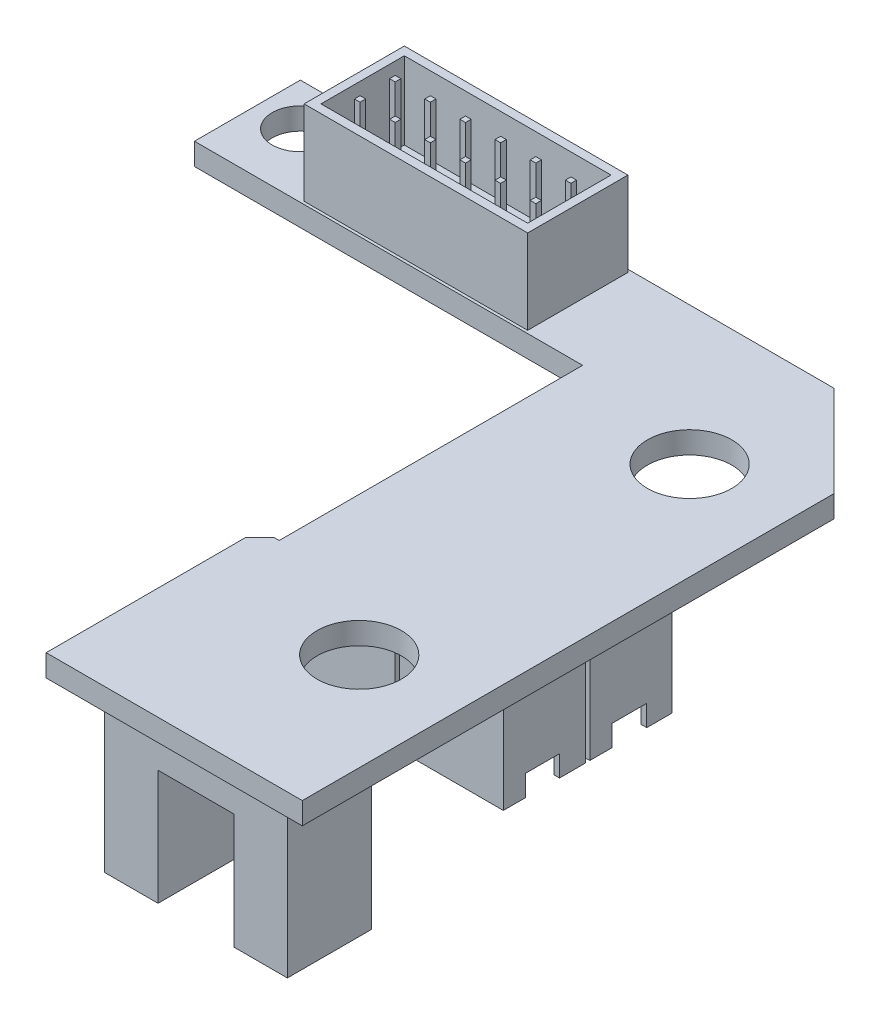
from build123d import *

# Parameters (mm, degrees)
EXTRUDE_1_DEPTH           = 1.56
SKETCH_2_W                = 7.53
SKETCH_2_H                = 1.56
EXTRUDE_2_DEPTH           = 27.61
SKETCH_3_W                = 7.84
SKETCH_3_H                = 5.85
EXTRUDE_3_DEPTH           = 7
SKETCH_4_W                = 7.04
SKETCH_4_H                = 5.05
CUT_EXTRUDE_1_DEPTH       = 6
SKETCH_5_W                = 2.414618678
SKETCH_5_H                = 1.5
CUT_EXTRUDE_2_DEPTH       = 54.380425251
SKETCH_6_W                = 2.414618678
SKETCH_6_H                = 1.5
CUT_EXTRUDE_3_DEPTH       = 58.697939305
SKETCH_7_W                = 7.4
SKETCH_7_H                = 5.85
EXTRUDE_4_DEPTH           = 7
SKETCH_8_W                = 6.6
SKETCH_8_H                = 5.05
CUT_EXTRUDE_4_DEPTH       = 6
SKETCH_9_W                = 2.456250035
SKETCH_9_H                = 1.5
CUT_EXTRUDE_5_DEPTH       = 59.136668291
SKETCH_10_W               = 2.456250035
SKETCH_10_H               = 1.5
CUT_EXTRUDE_6_DEPTH       = 63.78512722
SKETCH_11_W               = 7.4
SKETCH_11_H               = 5.85
EXTRUDE_5_DEPTH           = 7
SKETCH_12_W               = 6.6
SKETCH_12_H               = 5.05
CUT_EXTRUDE_7_DEPTH       = 6
SKETCH_13_W               = 2.414618678
SKETCH_13_H               = 1.5
CUT_EXTRUDE_8_DEPTH       = 59.136668291
SKETCH_14_W               = 2.414618678
SKETCH_14_H               = 1.5
CUT_EXTRUDE_9_DEPTH       = 63.78512722
SKETCH_15_W               = 7.84
SKETCH_15_H               = 5.85
EXTRUDE_6_DEPTH           = 7
SKETCH_16_W               = 7.04
SKETCH_16_H               = 5.05
CUT_EXTRUDE_10_DEPTH      = 6
SKETCH_17_W               = 2.456250035
SKETCH_17_H               = 1.5
CUT_EXTRUDE_11_DEPTH      = 54.380425251
SKETCH_18_W               = 2.456250035
SKETCH_18_H               = 1.5
CUT_EXTRUDE_12_DEPTH      = 58.697939305
SKETCH_19_W               = 13
SKETCH_19_H               = 6
EXTRUDE_7_DEPTH           = 10
CUT_EXTRUDE_13_REACH      = 65.749
SKETCH_20_W               = 5.4
SKETCH_20_H               = 8.2
SKETCH_21_W               = 0.837550725
SKETCH_21_H               = 0.544674091
EXTRUDE_8_DEPTH           = 4.5
SKETCH_22_W               = 0.837550725
SKETCH_22_H               = 0.544674091
EXTRUDE_9_DEPTH           = 4.5
SKETCH_23_W               = 0.837939267
SKETCH_23_H               = 0.544674091
EXTRUDE_10_DEPTH          = 4.5
SKETCH_24_W               = 0.837939267
SKETCH_24_H               = 0.544674091
EXTRUDE_11_DEPTH          = 4.5
SKETCH_25_W               = 0.837550725
SKETCH_25_H               = 0.544674091
EXTRUDE_12_DEPTH          = 4.5
SKETCH_26_W               = 0.837550725
SKETCH_26_H               = 0.544674091
EXTRUDE_13_DEPTH          = 4.5
SKETCH_27_W               = 0.837939267
SKETCH_27_H               = 0.544674091
EXTRUDE_14_DEPTH          = 4.5
SKETCH_28_W               = 0.837939267
SKETCH_28_H               = 0.544674091
EXTRUDE_15_DEPTH          = 4.5
SKETCH_29_W               = 15.9
SKETCH_29_H               = 7.13
EXTRUDE_16_DEPTH          = 6
SKETCH_30_W               = 14.7
SKETCH_30_H               = 5.93
CUT_EXTRUDE_14_DEPTH      = 5.5
SKETCH_31_W               = 0.4
SKETCH_31_H               = 0.4
EXTRUDE_17_DEPTH          = 5.5
SKETCH_32_W               = 0.4
SKETCH_32_H               = 0.4
EXTRUDE_18_DEPTH          = 5.5
SKETCH_33_W               = 0.4
SKETCH_33_H               = 0.4
EXTRUDE_19_DEPTH          = 5.5
SKETCH_34_W               = 0.4
SKETCH_34_H               = 0.4
EXTRUDE_20_DEPTH          = 5.5
SKETCH_35_W               = 0.4
SKETCH_35_H               = 0.4
EXTRUDE_21_DEPTH          = 5.5
SKETCH_36_W               = 0.4
SKETCH_36_H               = 0.4
EXTRUDE_22_DEPTH          = 5.5
SKETCH_37_W               = 0.4
SKETCH_37_H               = 0.4
EXTRUDE_23_DEPTH          = 5.5
SKETCH_38_W               = 0.4
SKETCH_38_H               = 0.4
EXTRUDE_24_DEPTH          = 5.5
SKETCH_39_W               = 0.4
SKETCH_39_H               = 0.4
EXTRUDE_25_DEPTH          = 5.5
SKETCH_40_W               = 0.4
SKETCH_40_H               = 0.4
EXTRUDE_26_DEPTH          = 5.5
SKETCH_41_W               = 0.4
SKETCH_41_H               = 0.4
EXTRUDE_27_DEPTH          = 5.5
SKETCH_42_W               = 0.4
SKETCH_42_H               = 0.4
EXTRUDE_28_DEPTH          = 5.5
HOLE_WIZARD_4_0_4_1_D     = 4
HOLE_WIZARD_4_0_4_1_DEPTH = 11.56
HOLE_WIZARD_6_0_6_1_D     = 6
HOLE_WIZARD_6_0_6_1_DEPTH = 11.56
CHAMFER_1_SIZE            = 6.5


with BuildPart() as part:
    # Эскиз1 → Бобышка-Вытянуть1 (new body)
    with BuildSketch(Plane.XZ.offset(1.56)):
        Polygon((-16.84, 29.11), (-16.84, 0), (0, 0), (0, 44.31), (-18.22, 44.31), (-18.22, 30.11), (-17.22, 29.11), align=None)
    extrude(amount=-EXTRUDE_1_DEPTH)

    # Эскиз2 → Бобышка-Вытянуть2 (add)
    with BuildSketch(Plane.ZY.offset(16.84)):
        with Locations((3.765, -0.78)):
            Rectangle(SKETCH_2_W, SKETCH_2_H)
    extrude(amount=EXTRUDE_2_DEPTH)

    # Эскиз3 → Бобышка-Вытянуть3 (add)
    with BuildSketch(Plane.XZ.offset(1.56)):
        with Locations((-12.42, 26.285)):
            Rectangle(SKETCH_3_W, SKETCH_3_H)
    extrude(amount=EXTRUDE_3_DEPTH)

    # Эскиз4 → Вырез-Вытянуть1 (cut)
    with BuildSketch(Plane.XZ.offset(8.56)):
        with Locations((-12.42, 26.285)):
            Rectangle(SKETCH_4_W, SKETCH_4_H)
    extrude(amount=-CUT_EXTRUDE_1_DEPTH, mode=Mode.SUBTRACT)

    # Эскиз5 → Вырез-Вытянуть2 (cut, through all)
    with BuildSketch(Plane(origin=(-15.94, 0, 0), x_dir=(0, 0, -1), z_dir=(1, 0, 0))):
        with Locations((-26.420386754, -7.81)):
            Rectangle(SKETCH_5_W, SKETCH_5_H)
    extrude(amount=-CUT_EXTRUDE_2_DEPTH, mode=Mode.SUBTRACT)

    # Эскиз6 → Вырез-Вытянуть3 (cut, through all)
    with BuildSketch(Plane(origin=(-8.5, 0, 0), x_dir=(0, 0, -1), z_dir=(1, 0, 0))):
        with Locations((-26.420386754, -7.81)):
            Rectangle(SKETCH_6_W, SKETCH_6_H)
    extrude(amount=-CUT_EXTRUDE_3_DEPTH, mode=Mode.SUBTRACT)

    # Эскиз7 → Бобышка-Вытянуть4 (add)
    with BuildSketch(Plane.XZ.offset(1.56)):
        with Locations((-4.5, 20.135)):
            Rectangle(SKETCH_7_W, SKETCH_7_H)
    extrude(amount=EXTRUDE_4_DEPTH)

    # Эскиз8 → Вырез-Вытянуть4 (cut)
    with BuildSketch(Plane.XZ.offset(8.56)):
        with Locations((-4.5, 20.135)):
            Rectangle(SKETCH_8_W, SKETCH_8_H)
    extrude(amount=-CUT_EXTRUDE_4_DEPTH, mode=Mode.SUBTRACT)

    # Эскиз9 → Вырез-Вытянуть5 (cut, through all)
    with BuildSketch(Plane(origin=(-7.8, 0, 0), x_dir=(0, 0, -1), z_dir=(1, 0, 0))):
        with Locations((-20.238130311, -7.81)):
            Rectangle(SKETCH_9_W, SKETCH_9_H)
    extrude(amount=-CUT_EXTRUDE_5_DEPTH, mode=Mode.SUBTRACT)

    # Эскиз10 → Вырез-Вытянуть6 (cut, through all)
    with BuildSketch(Plane(origin=(-0.8, 0, 0), x_dir=(0, 0, -1), z_dir=(1, 0, 0))):
        with Locations((-20.238130311, -7.81)):
            Rectangle(SKETCH_10_W, SKETCH_10_H)
    extrude(amount=-CUT_EXTRUDE_6_DEPTH, mode=Mode.SUBTRACT)

    # Эскиз11 → Бобышка-Вытянуть5 (add)
    with BuildSketch(Plane.XZ.offset(1.56)):
        with Locations((-4.5, 26.285)):
            Rectangle(SKETCH_11_W, SKETCH_11_H)
    extrude(amount=EXTRUDE_5_DEPTH)

    # Эскиз12 → Вырез-Вытянуть7 (cut)
    with BuildSketch(Plane.XZ.offset(8.56)):
        with Locations((-4.5, 26.285)):
            Rectangle(SKETCH_12_W, SKETCH_12_H)
    extrude(amount=-CUT_EXTRUDE_7_DEPTH, mode=Mode.SUBTRACT)

    # Эскиз13 → Вырез-Вытянуть8 (cut, through all)
    with BuildSketch(Plane(origin=(-7.8, 0, 0), x_dir=(0, 0, -1), z_dir=(1, 0, 0))):
        with Locations((-26.420386754, -7.81)):
            Rectangle(SKETCH_13_W, SKETCH_13_H)
    extrude(amount=-CUT_EXTRUDE_8_DEPTH, mode=Mode.SUBTRACT)

    # Эскиз14 → Вырез-Вытянуть9 (cut, through all)
    with BuildSketch(Plane(origin=(-0.8, 0, 0), x_dir=(0, 0, -1), z_dir=(1, 0, 0))):
        with Locations((-26.420386754, -7.81)):
            Rectangle(SKETCH_14_W, SKETCH_14_H)
    extrude(amount=-CUT_EXTRUDE_9_DEPTH, mode=Mode.SUBTRACT)

    # Эскиз15 → Бобышка-Вытянуть6 (add)
    with BuildSketch(Plane.XZ.offset(1.56)):
        with Locations((-12.42, 20.135)):
            Rectangle(SKETCH_15_W, SKETCH_15_H)
    extrude(amount=EXTRUDE_6_DEPTH)

    # Эскиз16 → Вырез-Вытянуть10 (cut)
    with BuildSketch(Plane.XZ.offset(8.56)):
        with Locations((-12.42, 20.135)):
            Rectangle(SKETCH_16_W, SKETCH_16_H)
    extrude(amount=-CUT_EXTRUDE_10_DEPTH, mode=Mode.SUBTRACT)

    # Эскиз17 → Вырез-Вытянуть11 (cut, through all)
    with BuildSketch(Plane(origin=(-15.94, 0, 0), x_dir=(0, 0, -1), z_dir=(1, 0, 0))):
        with Locations((-20.238130311, -7.81)):
            Rectangle(SKETCH_17_W, SKETCH_17_H)
    extrude(amount=-CUT_EXTRUDE_11_DEPTH, mode=Mode.SUBTRACT)

    # Эскиз18 → Вырез-Вытянуть12 (cut, through all)
    with BuildSketch(Plane(origin=(-8.5, 0, 0), x_dir=(0, 0, -1), z_dir=(1, 0, 0))):
        with Locations((-20.238130311, -7.81)):
            Rectangle(SKETCH_18_W, SKETCH_18_H)
    extrude(amount=-CUT_EXTRUDE_12_DEPTH, mode=Mode.SUBTRACT)

    # Эскиз19 → Бобышка-Вытянуть7 (add)
    with BuildSketch(Plane.XZ.offset(1.56)):
        with Locations((-7.66, 41.21)):
            Rectangle(SKETCH_19_W, SKETCH_19_H)
    extrude(amount=EXTRUDE_7_DEPTH)

    # Эскиз20 → Вырез-Вытянуть13 (cut, up to next)
    with BuildSketch(Plane.XY.offset(44.21), mode=Mode.PRIVATE) as cut_extrude_13_sk1:
        with Locations((-7.66, -7.46)):
            Rectangle(SKETCH_20_W, SKETCH_20_H)
    cut_extrude_13_tool1 = extrude(cut_extrude_13_sk1.sketch, amount=-CUT_EXTRUDE_13_REACH, mode=Mode.PRIVATE) & part.part
    add(cut_extrude_13_tool1.solids().sort_by_distance((-7.66, -7.46, 44.21))[0], mode=Mode.SUBTRACT)

    # Эскиз21 → Бобышка-Вытянуть8 (add)
    with BuildSketch(Plane.XZ.offset(2.56)):
        with Locations((-6.100901038, 26.307048006)):
            Rectangle(SKETCH_21_W, SKETCH_21_H)
    extrude(amount=EXTRUDE_8_DEPTH)

    # Эскиз22 → Бобышка-Вытянуть9 (add)
    with BuildSketch(Plane.XZ.offset(2.56)):
        with Locations((-14.100901039, 26.307048006)):
            Rectangle(SKETCH_22_W, SKETCH_22_H)
    extrude(amount=EXTRUDE_9_DEPTH)

    # Эскиз23 → Бобышка-Вытянуть10 (add)
    with BuildSketch(Plane.XZ.offset(2.56)):
        with Locations((-2.879258672, 26.307048006)):
            Rectangle(SKETCH_23_W, SKETCH_23_H)
    extrude(amount=EXTRUDE_10_DEPTH)

    # Эскиз24 → Бобышка-Вытянуть11 (add)
    with BuildSketch(Plane.XZ.offset(2.56)):
        with Locations((-10.879258672, 26.307048006)):
            Rectangle(SKETCH_24_W, SKETCH_24_H)
    extrude(amount=EXTRUDE_11_DEPTH)

    # Эскиз25 → Бобышка-Вытянуть12 (add)
    with BuildSketch(Plane.XZ.offset(2.56)):
        with Locations((-14.100901039, 20.307048006)):
            Rectangle(SKETCH_25_W, SKETCH_25_H)
    extrude(amount=EXTRUDE_12_DEPTH)

    # Эскиз26 → Бобышка-Вытянуть13 (add)
    with BuildSketch(Plane.XZ.offset(2.56)):
        with Locations((-6.100901038, 20.307048006)):
            Rectangle(SKETCH_26_W, SKETCH_26_H)
    extrude(amount=EXTRUDE_13_DEPTH)

    # Эскиз27 → Бобышка-Вытянуть14 (add)
    with BuildSketch(Plane.XZ.offset(2.56)):
        with Locations((-10.879258672, 20.307048006)):
            Rectangle(SKETCH_27_W, SKETCH_27_H)
    extrude(amount=EXTRUDE_14_DEPTH)

    # Эскиз28 → Бобышка-Вытянуть15 (add)
    with BuildSketch(Plane.XZ.offset(2.56)):
        with Locations((-2.879258672, 20.307048006)):
            Rectangle(SKETCH_28_W, SKETCH_28_H)
    extrude(amount=EXTRUDE_15_DEPTH)

    # Эскиз29 → Бобышка-Вытянуть16 (add)
    with BuildSketch(Plane(origin=(0, 0, 0), x_dir=(-1, 0, 0), z_dir=(0, 1, 0))):
        with Locations((28.9, 3.765)):
            Rectangle(SKETCH_29_W, SKETCH_29_H)
    extrude(amount=EXTRUDE_16_DEPTH)

    # Эскиз30 → Вырез-Вытянуть14 (cut)
    with BuildSketch(Plane(origin=(0, 6, 0), x_dir=(-1, 0, 0), z_dir=(0, 1, 0))):
        with Locations((28.9, 3.765)):
            Rectangle(SKETCH_30_W, SKETCH_30_H)
    extrude(amount=-CUT_EXTRUDE_14_DEPTH, mode=Mode.SUBTRACT)

    # Эскиз31 → Бобышка-Вытянуть17 (add)
    with BuildSketch(Plane(origin=(0, 0.5, 0), x_dir=(-1, 0, 0), z_dir=(0, 1, 0))):
        with Locations((22.664248115, 5.036606831)):
            Rectangle(SKETCH_31_W, SKETCH_31_H)
    extrude(amount=EXTRUDE_17_DEPTH)

    # Эскиз32 → Бобышка-Вытянуть18 (add)
    with BuildSketch(Plane(origin=(0, 0.5, 0), x_dir=(-1, 0, 0), z_dir=(0, 1, 0))):
        with Locations((25.164248115, 5.036606831)):
            Rectangle(SKETCH_32_W, SKETCH_32_H)
    extrude(amount=EXTRUDE_18_DEPTH)

    # Эскиз33 → Бобышка-Вытянуть19 (add)
    with BuildSketch(Plane(origin=(0, 0.5, 0), x_dir=(-1, 0, 0), z_dir=(0, 1, 0))):
        with Locations((27.664248115, 5.036606831)):
            Rectangle(SKETCH_33_W, SKETCH_33_H)
    extrude(amount=EXTRUDE_19_DEPTH)

    # Эскиз34 → Бобышка-Вытянуть20 (add)
    with BuildSketch(Plane(origin=(0, 0.5, 0), x_dir=(-1, 0, 0), z_dir=(0, 1, 0))):
        with Locations((30.164248115, 5.036606831)):
            Rectangle(SKETCH_34_W, SKETCH_34_H)
    extrude(amount=EXTRUDE_20_DEPTH)

    # Эскиз35 → Бобышка-Вытянуть21 (add)
    with BuildSketch(Plane(origin=(0, 0.5, 0), x_dir=(-1, 0, 0), z_dir=(0, 1, 0))):
        with Locations((32.664248115, 5.036606831)):
            Rectangle(SKETCH_35_W, SKETCH_35_H)
    extrude(amount=EXTRUDE_21_DEPTH)

    # Эскиз36 → Бобышка-Вытянуть22 (add)
    with BuildSketch(Plane(origin=(0, 0.5, 0), x_dir=(-1, 0, 0), z_dir=(0, 1, 0))):
        with Locations((35.164248115, 5.036606831)):
            Rectangle(SKETCH_36_W, SKETCH_36_H)
    extrude(amount=EXTRUDE_22_DEPTH)

    # Эскиз37 → Бобышка-Вытянуть23 (add)
    with BuildSketch(Plane(origin=(0, 0.5, 0), x_dir=(-1, 0, 0), z_dir=(0, 1, 0))):
        with Locations((35.164248115, 2.536606831)):
            Rectangle(SKETCH_37_W, SKETCH_37_H)
    extrude(amount=EXTRUDE_23_DEPTH)

    # Эскиз38 → Бобышка-Вытянуть24 (add)
    with BuildSketch(Plane(origin=(0, 0.5, 0), x_dir=(-1, 0, 0), z_dir=(0, 1, 0))):
        with Locations((32.664248115, 2.536606831)):
            Rectangle(SKETCH_38_W, SKETCH_38_H)
    extrude(amount=EXTRUDE_24_DEPTH)

    # Эскиз39 → Бобышка-Вытянуть25 (add)
    with BuildSketch(Plane(origin=(0, 0.5, 0), x_dir=(-1, 0, 0), z_dir=(0, 1, 0))):
        with Locations((30.164248115, 2.536606831)):
            Rectangle(SKETCH_39_W, SKETCH_39_H)
    extrude(amount=EXTRUDE_25_DEPTH)

    # Эскиз40 → Бобышка-Вытянуть26 (add)
    with BuildSketch(Plane(origin=(0, 0.5, 0), x_dir=(-1, 0, 0), z_dir=(0, 1, 0))):
        with Locations((27.664248115, 2.536606831)):
            Rectangle(SKETCH_40_W, SKETCH_40_H)
    extrude(amount=EXTRUDE_26_DEPTH)

    # Эскиз41 → Бобышка-Вытянуть27 (add)
    with BuildSketch(Plane(origin=(0, 0.5, 0), x_dir=(-1, 0, 0), z_dir=(0, 1, 0))):
        with Locations((25.164248115, 2.536606831)):
            Rectangle(SKETCH_41_W, SKETCH_41_H)
    extrude(amount=EXTRUDE_27_DEPTH)

    # Эскиз42 → Бобышка-Вытянуть28 (add)
    with BuildSketch(Plane(origin=(0, 0.5, 0), x_dir=(-1, 0, 0), z_dir=(0, 1, 0))):
        with Locations((22.664248115, 2.536606831)):
            Rectangle(SKETCH_42_W, SKETCH_42_H)
    extrude(amount=EXTRUDE_28_DEPTH)

    # Диаметр отверстия Ø4.0 (4)1
    with Locations(Plane(origin=(0, 0, 0), x_dir=(1, 0, 0), z_dir=(0, 1, 0))):
        with Locations((-41.45, -3)):
            Hole(HOLE_WIZARD_4_0_4_1_D / 2, depth=HOLE_WIZARD_4_0_4_1_DEPTH)

    # Диаметр отверстия Ø6.0 (6)1
    with Locations(Plane(origin=(0, 0, 0), x_dir=(1, 0, 0), z_dir=(0, 1, 0))):
        with Locations((-6.95, -9.81), (-6.95, -33.31)):
            Hole(HOLE_WIZARD_6_0_6_1_D / 2, depth=HOLE_WIZARD_6_0_6_1_DEPTH)

    # Фаска1
    chamfer_1_edges = [part.edges().sort_by_distance(p)[0] for p in [
        (0, -0.78, 0),
    ]]
    chamfer(chamfer_1_edges, length=CHAMFER_1_SIZE)


solid = part.part
